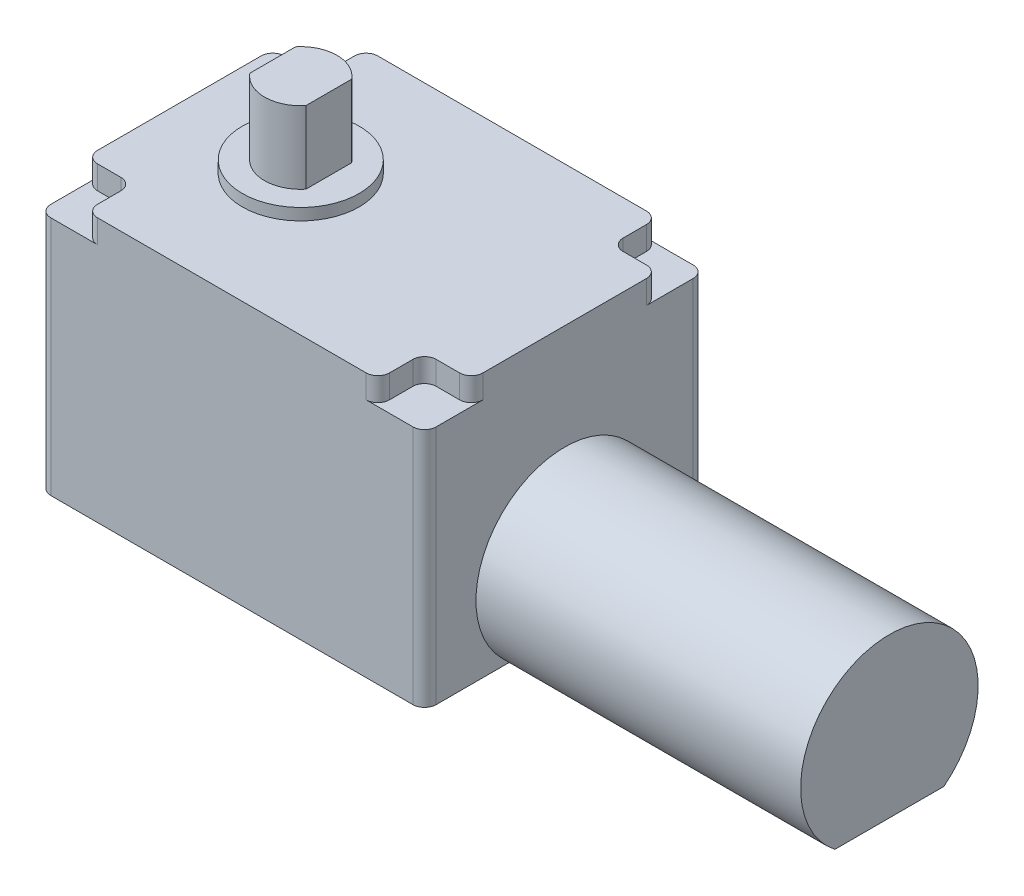
from build123d import *

# Parameters (mm, degrees)
SKETCH1_W           = 16.5
SKETCH1_H           = 12
GEARBOX_DEPTH       = 11.3
SKETCH2_R           = 2.5
SHAFTBASE_DEPTH     = 0.5
SHAFT_DEPTH         = 3.1
MOTOR_DEPTH         = 13.9
SKETCH5_W           = 2
SKETCH5_H           = 2
SCREWINSETS_DEPTH   = 1
SKETCH6_R           = 1.25
BACKEXTRUSION_DEPTH = 0.6
FILLETS_R           = 0.5


with BuildPart() as part:
    # Sketch1 → gearbox (new body)
    with BuildSketch(Plane(origin=(0, 0, 0), x_dir=(1, 0, 0), z_dir=(0, 1, 0))):
        with Locations((3.05, 0)):
            Rectangle(SKETCH1_W, SKETCH1_H)
    extrude(amount=-GEARBOX_DEPTH)

    # Sketch2 → shaftbase (add)
    with BuildSketch(Plane(origin=(0, 0, 0), x_dir=(1, 0, 0), z_dir=(0, 1, 0))):
        with Locations(Location((0, 0, 0), (0, 0, 270))):
            Circle(SKETCH2_R)
    extrude(amount=SHAFTBASE_DEPTH)

    # Sketch3 → shaft (add)
    with BuildSketch(Plane(origin=(0, 0.5, 0), x_dir=(1, 0, 0), z_dir=(0, 1, 0))):
        with BuildLine():
            Line((-1.2, 0.981070844), (-1.2, -0.981070844))
            ThreePointArc((-1.2, -0.981070844), (0, -1.55), (1.2, -0.981070844))
            Line((1.2, -0.981070844), (1.2, 0.981070844))
            ThreePointArc((1.2, 0.981070844), (0, 1.55), (-1.2, 0.981070844))
        make_face()
    extrude(amount=SHAFT_DEPTH)

    # Sketch4 → motor (add)
    with BuildSketch(Plane(origin=(11.3, 0, 0), x_dir=(0, 0, -1), z_dir=(1, 0, 0))):
        with BuildLine():
            Line((2.332380758, -11.3), (-2.332380758, -11.3))
            ThreePointArc((-2.332380758, -11.3), (0, -4.5), (2.332380758, -11.3))
        make_face()
    extrude(amount=MOTOR_DEPTH)

    # Sketch5 → screwinsets (cut)
    with BuildSketch(Plane(origin=(0, 0, 0), x_dir=(1, 0, 0), z_dir=(0, 1, 0))):
        with Locations((-4.2, 5)):
            Rectangle(SKETCH5_W, SKETCH5_H)
        with Locations((10.3, 5)):
            Rectangle(SKETCH5_W, SKETCH5_H)
        with Locations((10.3, -5)):
            Rectangle(SKETCH5_W, SKETCH5_H)
        with Locations((-4.2, -5)):
            Rectangle(SKETCH5_W, SKETCH5_H)
    extrude(amount=-SCREWINSETS_DEPTH, mode=Mode.SUBTRACT)

    # Sketch6 → backextrusion (add)
    with BuildSketch(Plane.XZ.offset(11.3)):
        with Locations(Location((5, 0, 0), (0, 0, 90))):
            Circle(SKETCH6_R)
    extrude(amount=BACKEXTRUSION_DEPTH)

    # fillets
    fillets_edges = [part.edges().sort_by_distance(p)[0] for p in [
        (-3.2, -0.5, -6),
        (-5.2, -0.5, -4),
        (-5.2, -0.5, 4),
        (-3.2, -0.5, 6),
        (9.3, -0.5, -6),
        (11.3, -0.5, -4),
        (11.3, -0.5, 4),
        (9.3, -0.5, 6),
        (-3.2, -0.5, -4),
        (9.3, -0.5, 4),
        (9.3, -0.5, -4),
        (-3.2, -0.5, 4),
        (-5.2, -6.15, -6),
        (-5.2, -6.15, 6),
        (11.3, -6.15, -6),
        (11.3, -6.15, 6),
    ]]
    fillet(fillets_edges, radius=FILLETS_R)


solid = part.part
